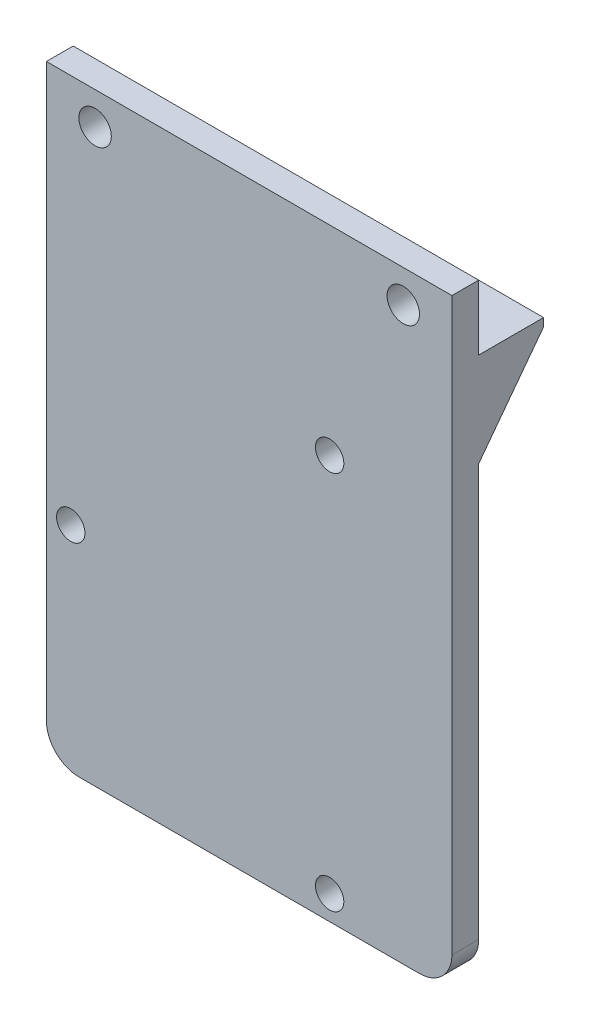
from build123d import *

# Parameters (mm, degrees)
SKETCH_1_W      = 50
SKETCH_1_H      = 74.4
SKETCH_1_R      = 1.75
SKETCH_1_R_2    = 2
EXTRUDE_2_DEPTH = 3.3
FILLET_1_R      = 4
EXTRUDE_3_DEPTH = 50


with BuildPart() as part:
    # ｽｹｯﾁ1 → ﾎﾞｽ - 押し出し2 (new body)
    with BuildSketch(Plane.XY):
        with Locations((-9.92, -12.6)):
            Rectangle(SKETCH_1_W, SKETCH_1_H)
        Circle(SKETCH_1_R, mode=Mode.SUBTRACT)
        with Locations((0, -46.8)):
            Circle(SKETCH_1_R, mode=Mode.SUBTRACT)
        with Locations((-31.92, -23.4)):
            Circle(SKETCH_1_R, mode=Mode.SUBTRACT)
        with Locations((9.08, 20.6)):
            Circle(SKETCH_1_R_2, mode=Mode.SUBTRACT)
        with Locations((-28.92, 20.6)):
            Circle(SKETCH_1_R_2, mode=Mode.SUBTRACT)
    extrude(amount=EXTRUDE_2_DEPTH)

    # ﾌｨﾚｯﾄ1
    fillet_1_edges = [part.edges().sort_by_distance(p)[0] for p in [
        (15.08, -49.8, 1.65),
        (-34.92, -49.8, 1.65),
    ]]
    fillet(fillet_1_edges, radius=FILLET_1_R)

    # ｽｹｯﾁ3 → ﾎﾞｽ - 押し出し3 (add)
    with BuildSketch(Plane(origin=(15.08, 0, 0), x_dir=(0, 0, -1), z_dir=(1, 0, 0))):
        Polygon((0, 16.6), (8, 16.6), (8, 15.6), (0, 5), align=None)
    extrude(amount=-EXTRUDE_3_DEPTH)


solid = part.part
